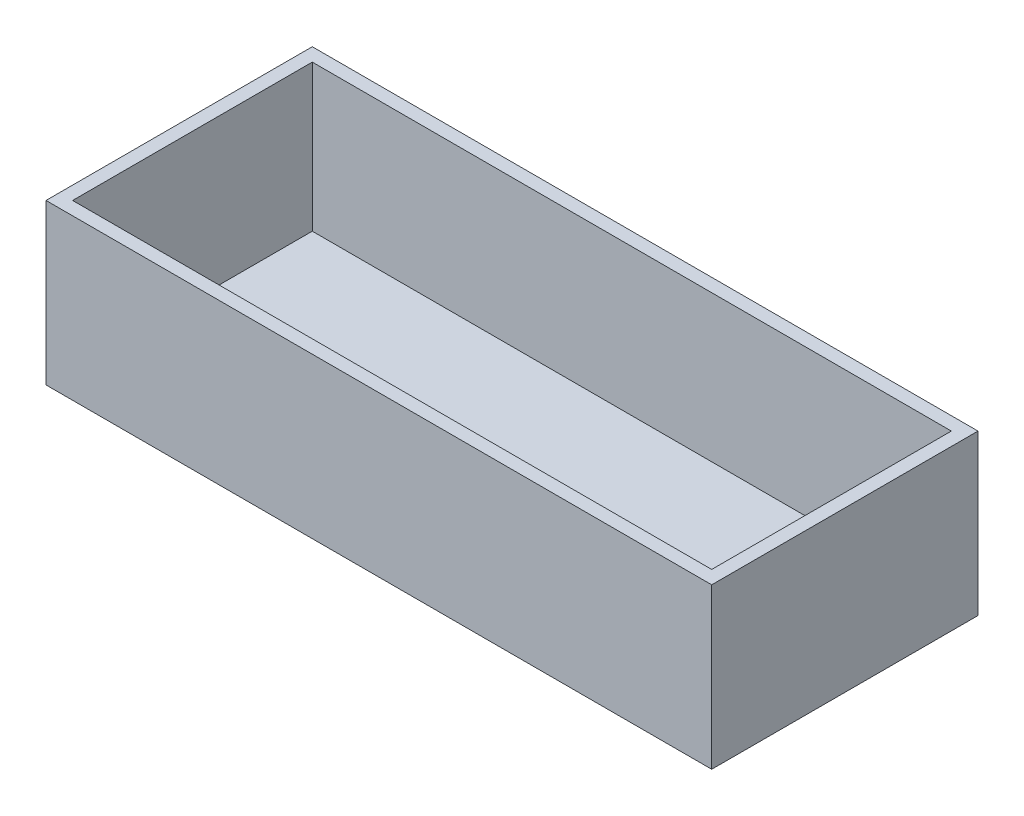
from build123d import *

# Parameters (mm, degrees)
SKETCH_1_W      = 250
SKETCH_1_H      = 60
EXTRUDE_1_DEPTH = 100
SHELL_1_T       = -5


with BuildPart() as part:
    # 草图1 → 凸台-拉伸1 (new body)
    with BuildSketch(Plane.XY):
        Rectangle(SKETCH_1_W, SKETCH_1_H)
    extrude(amount=EXTRUDE_1_DEPTH)

    # 抽壳1
    shell_1_openings = [part.faces().sort_by_distance(p)[0] for p in [
        (0, 30, 50),
    ]]
    offset(amount=SHELL_1_T, openings=shell_1_openings, kind=Kind.INTERSECTION)


solid = part.part
